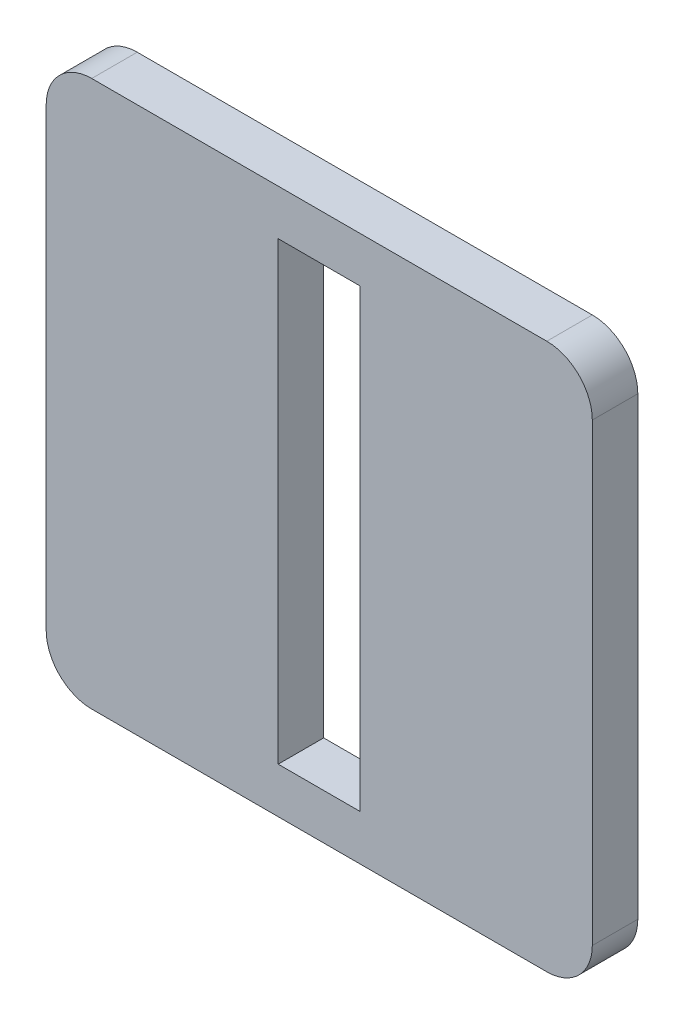
from build123d import *

# Parameters (mm, degrees)
BOSS_EXTRUDE1_DEPTH = 10
SKETCH2_W           = 17.948717949
SKETCH2_H           = 100
CUT_EXTRUDE22_DEPTH = 10


with BuildPart() as part:
    # Sketch1 → Boss-Extrude1 (new body)
    with BuildSketch(Plane.XY):
        with BuildLine():
            Line((-50, 60), (50, 60))
            ThreePointArc((50, 60), (57.071067812, 57.071067812), (60, 50))
            Line((60, 50), (60, -50))
            ThreePointArc((60, -50), (57.071067812, -57.071067812), (50, -60))
            Line((50, -60), (-50, -60))
            ThreePointArc((-50, -60), (-57.071067812, -57.071067812), (-60, -50))
            Line((-60, -50), (-60, 50))
            ThreePointArc((-60, 50), (-57.071067812, 57.071067812), (-50, 60))
        make_face()
    extrude(amount=BOSS_EXTRUDE1_DEPTH)

    # Sketch2 → Cut-Extrude22 (cut)
    with BuildSketch(Plane.XY.offset(10)):
        with Locations((-0.051282052, 0)):
            Rectangle(SKETCH2_W, SKETCH2_H)
    extrude(amount=-CUT_EXTRUDE22_DEPTH, mode=Mode.SUBTRACT)


solid = part.part
